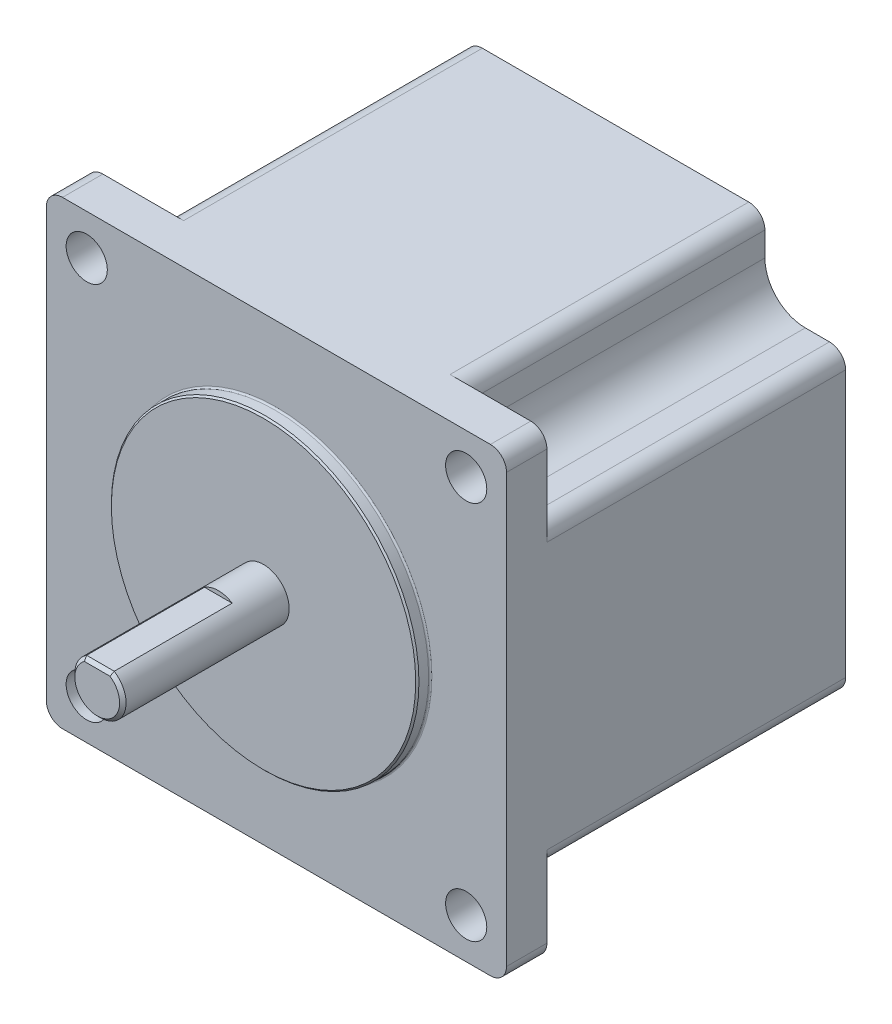
from build123d import *

# Parameters (mm, degrees)
BOSS_EXTRU_1_DEPTH      = 42
ESQUISSE3_R             = 19.05
BOSS_EXTRU_2_DEPTH      = 1.6
CHANFREIN1_SIZE         = 0.2
CONG_1_R                = 0.2
ESQUISSE4_R             = 3.175
BOSS_EXTRU_3_DEPTH      = 5.6
BOSS_EXTRU_4_DEPTH      = 15
CHANFREIN2_SIZE         = 0.4
ENL_V_START             = -37
ENL_V_MAT_EXTRU_1_DEPTH = 37
ENL_V_MAT_EXTRU_2_DEPTH = 59.210823736


with BuildPart() as part:
    # Esquisse1 → Boss.-Extru.1 (new body)
    with BuildSketch(Plane.XY):
        with BuildLine():
            Line((-26.5, -28.5), (26.5, -28.5))
            ThreePointArc((26.5, -28.5), (27.914213562, -27.914213562), (28.5, -26.5))
            Line((28.5, -26.5), (28.5, 26.5))
            ThreePointArc((28.5, 26.5), (27.914213562, 27.914213562), (26.5, 28.5))
            Line((26.5, 28.5), (-26.5, 28.5))
            ThreePointArc((-26.5, 28.5), (-27.914213562, 27.914213562), (-28.5, 26.5))
            Line((-28.5, 26.5), (-28.5, -26.5))
            ThreePointArc((-28.5, -26.5), (-27.914213562, -27.914213562), (-26.5, -28.5))
        make_face()
    extrude(amount=-BOSS_EXTRU_1_DEPTH)

    # Esquisse3 → Boss.-Extru.2 (add)
    with BuildSketch(Plane.XY):
        Circle(ESQUISSE3_R)
    extrude(amount=BOSS_EXTRU_2_DEPTH)

    # Chanfrein1
    chanfrein1_edges = [part.edges().sort_by_distance(p)[0] for p in [
        (-19.05, 0, 1.6),
    ]]
    chamfer(chanfrein1_edges, length=CHANFREIN1_SIZE)

    # Congé1
    cong_1_edges = [part.edges().sort_by_distance(p)[0] for p in [
        (-19.05, 0, 0),
    ]]
    fillet(cong_1_edges, radius=CONG_1_R)

    # Esquisse4 → Boss.-Extru.3 (add)
    with BuildSketch(Plane.XY.offset(1.6)):
        Circle(ESQUISSE4_R)
    extrude(amount=BOSS_EXTRU_3_DEPTH)

    # Esquisse5 → Boss.-Extru.4 (add)
    with BuildSketch(Plane.XY.offset(7.2)):
        with BuildLine():
            Line((-1.710263138, 2.675), (1.710263138, 2.675))
            ThreePointArc((1.710263138, 2.675), (0, -3.175), (-1.710263138, 2.675))
        make_face()
    extrude(amount=BOSS_EXTRU_4_DEPTH)

    # Chanfrein2
    chanfrein2_edges = [part.edges().sort_by_distance(p)[0] for p in [
        (0, -3.175, 22.2),
        (0, 2.675, 22.2),
    ]]
    chamfer(chanfrein2_edges, length=CHANFREIN2_SIZE)

    # Esquisse7 → Enlèv. mat.-Extru.1 (cut)
    with BuildSketch(Plane(origin=(0, 0, -42), x_dir=(-1, 0, 0), z_dir=(0, 0, -1)).offset(ENL_V_START)):
        with BuildLine():
            Line((-28.5, 26.5), (-28.5, 16.5))
            ThreePointArc((-28.5, 16.5), (-27.914213562, 17.914213562), (-26.5, 18.5))
            Line((-26.5, 18.5), (-23.5, 18.5))
            ThreePointArc((-23.5, 18.5), (-19.964466094, 19.964466094), (-18.5, 23.5))
            Line((-18.5, 23.5), (-18.5, 26.5))
            ThreePointArc((-18.5, 26.5), (-17.914213562, 27.914213562), (-16.5, 28.5))
            Line((-16.5, 28.5), (-26.5, 28.5))
            ThreePointArc((-26.5, 28.5), (-27.914213562, 27.914213562), (-28.5, 26.5))
        make_face()
        with BuildLine():
            Line((26.5, 28.5), (16.5, 28.5))
            ThreePointArc((16.5, 28.5), (17.914213562, 27.914213562), (18.5, 26.5))
            Line((18.5, 26.5), (18.5, 23.5))
            ThreePointArc((18.5, 23.5), (19.964466094, 19.964466094), (23.5, 18.5))
            Line((23.5, 18.5), (26.5, 18.5))
            ThreePointArc((26.5, 18.5), (27.914213562, 17.914213562), (28.5, 16.5))
            Line((28.5, 16.5), (28.5, 26.5))
            ThreePointArc((28.5, 26.5), (27.914213562, 27.914213562), (26.5, 28.5))
        make_face()
        with BuildLine():
            ThreePointArc((18.5, -26.5), (17.914213562, -27.914213562), (16.5, -28.5))
            Line((16.5, -28.5), (26.5, -28.5))
            ThreePointArc((26.5, -28.5), (27.914213562, -27.914213562), (28.5, -26.5))
            Line((28.5, -26.5), (28.5, -16.5))
            ThreePointArc((28.5, -16.5), (27.914213562, -17.914213562), (26.5, -18.5))
            Line((26.5, -18.5), (23.5, -18.5))
            ThreePointArc((23.5, -18.5), (19.964466094, -19.964466094), (18.5, -23.5))
            Line((18.5, -23.5), (18.5, -26.5))
        make_face()
        with BuildLine():
            ThreePointArc((-18.5, -23.5), (-19.964466094, -19.964466094), (-23.5, -18.5))
            Line((-23.5, -18.5), (-26.5, -18.5))
            ThreePointArc((-26.5, -18.5), (-27.914213562, -17.914213562), (-28.5, -16.5))
            Line((-28.5, -16.5), (-28.5, -26.5))
            ThreePointArc((-28.5, -26.5), (-27.914213562, -27.914213562), (-26.5, -28.5))
            Line((-26.5, -28.5), (-16.5, -28.5))
            ThreePointArc((-16.5, -28.5), (-17.914213562, -27.914213562), (-18.5, -26.5))
            Line((-18.5, -26.5), (-18.5, -23.5))
        make_face()
    extrude(amount=ENL_V_MAT_EXTRU_1_DEPTH, mode=Mode.SUBTRACT)

    # Esquisse6 → Enlèv. mat.-Extru.2 (cut, through all)
    with BuildSketch(Plane.XY):
        with BuildLine():
            Line((-23.5, 20.95), (-23.5, 23.5))
            Line((-23.5, 23.5), (-20.95, 23.5))
            ThreePointArc((-20.95, 23.5), (-25.303122292, 25.303122292), (-23.5, 20.95))
        make_face()
        with BuildLine():
            Line((-20.95, 23.5), (-23.5, 23.5))
            Line((-23.5, 23.5), (-23.5, 20.95))
            ThreePointArc((-23.5, 20.95), (-21.696877708, 21.696877708), (-20.95, 23.5))
        make_face()
        with BuildLine():
            ThreePointArc((26.05, 23.5), (23.5, 26.05), (20.95, 23.5))
            Line((20.95, 23.5), (23.5, 23.5))
            Line((23.5, 23.5), (23.5, 20.95))
            ThreePointArc((23.5, 20.95), (25.303122292, 21.696877708), (26.05, 23.5))
        make_face()
        with BuildLine():
            Line((23.5, 23.5), (20.95, 23.5))
            ThreePointArc((20.95, 23.5), (21.696877708, 21.696877708), (23.5, 20.95))
            Line((23.5, 20.95), (23.5, 23.5))
        make_face()
        with BuildLine():
            ThreePointArc((26.05, -23.5), (25.303122292, -21.696877708), (23.5, -20.95))
            Line((23.5, -20.95), (23.5, -23.5))
            Line((23.5, -23.5), (20.95, -23.5))
            ThreePointArc((20.95, -23.5), (23.5, -26.05), (26.05, -23.5))
        make_face()
        with BuildLine():
            Line((23.5, -23.5), (23.5, -20.95))
            ThreePointArc((23.5, -20.95), (21.696877708, -21.696877708), (20.95, -23.5))
            Line((20.95, -23.5), (23.5, -23.5))
        make_face()
        with BuildLine():
            ThreePointArc((-20.95, -23.5), (-21.696877708, -21.696877708), (-23.5, -20.95))
            Line((-23.5, -20.95), (-23.5, -23.5))
            Line((-23.5, -23.5), (-20.95, -23.5))
        make_face()
        with BuildLine():
            Line((-23.5, -23.5), (-23.5, -20.95))
            ThreePointArc((-23.5, -20.95), (-25.303122292, -25.303122292), (-20.95, -23.5))
            Line((-20.95, -23.5), (-23.5, -23.5))
        make_face()
    extrude(amount=-ENL_V_MAT_EXTRU_2_DEPTH, mode=Mode.SUBTRACT)


solid = part.part
